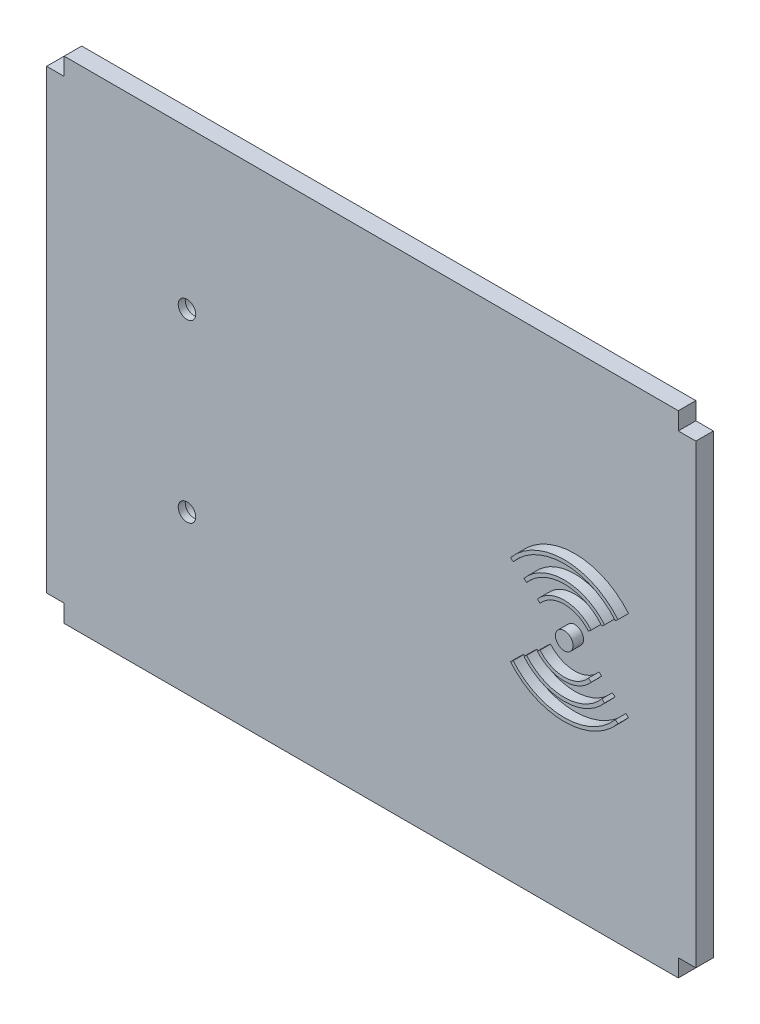
from build123d import *

# Parameters (mm, degrees)
BOSS_EXTRUDE1_DEPTH = 5
SKETCH2_R           = 2.5
CUT_EXTRUDE1_DEPTH  = 5
SKETCH3_R           = 3
CUT_EXTRUDE2_DEPTH  = 3
SKETCH4_R           = 2.5
BOSS_EXTRUDE2_DEPTH = 3


with BuildPart() as part:
    # Sketch1 → Boss-Extrude1 (new body)
    with BuildSketch(Plane.XY):
        Polygon((-87.5, 70), (-87.5, 65), (-92.5, 65), (-92.5, -65), (-87.5, -65), (-87.5, -70), (87.5, -70), (87.5, -65), (92.5, -65), (92.5, 65), (87.5, 65), (87.5, 70), align=None)
    extrude(amount=BOSS_EXTRUDE1_DEPTH)

    # Sketch2 → Cut-Extrude1 (cut)
    with BuildSketch(Plane.XY.offset(5)):
        with Locations((-52.5, -25)):
            Circle(SKETCH2_R)
        with Locations((-52.5, 25)):
            Circle(SKETCH2_R)
    extrude(amount=-CUT_EXTRUDE1_DEPTH, mode=Mode.SUBTRACT)

    # Sketch3 → Cut-Extrude2 (cut)
    with BuildSketch(Plane(origin=(0, 0, 0), x_dir=(-1, 0, 0), z_dir=(0, 0, -1))):
        with Locations((52.5, 25)):
            Circle(SKETCH3_R)
        with Locations((52.5, -25)):
            Circle(SKETCH3_R)
    extrude(amount=-CUT_EXTRUDE2_DEPTH, mode=Mode.SUBTRACT)

    # Sketch4 → Boss-Extrude2 (add)
    with BuildSketch(Plane.XY.offset(5)):
        with Locations(Location((58, 0, 0), (0, 0, 180))):
            Circle(SKETCH4_R)
        with BuildLine():
            Line((51.105600012, -5.785088487), (50.339555569, -6.427876097))
            ThreePointArc((50.339555569, -6.427876097), (58, -10), (65.660444431, -6.427876097))
            Line((65.660444431, -6.427876097), (64.894399988, -5.785088487))
            ThreePointArc((64.894399988, -5.785088487), (58, -9), (51.105600012, -5.785088487))
        make_face()
        with BuildLine():
            Line((68.724622204, -8.999026536), (69.490666647, -9.641814145))
            ThreePointArc((69.490666647, -9.641814145), (58, -15), (46.509333353, -9.641814145))
            Line((46.509333353, -9.641814145), (47.275377796, -8.999026536))
            ThreePointArc((47.275377796, -8.999026536), (58, -14), (68.724622204, -8.999026536))
        make_face()
        with BuildLine():
            Line((43.445155581, 12.212964584), (42.679111138, 12.855752194))
            ThreePointArc((42.679111138, 12.855752194), (58, 20), (73.320888862, 12.855752194))
            Line((73.320888862, 12.855752194), (72.554844419, 12.212964584))
            ThreePointArc((72.554844419, 12.212964584), (58, 19), (43.445155581, 12.212964584))
        make_face()
        with BuildLine():
            Line((47.275377796, 8.999026536), (46.509333353, 9.641814145))
            ThreePointArc((46.509333353, 9.641814145), (58, 15), (69.490666647, 9.641814145))
            Line((69.490666647, 9.641814145), (68.724622204, 8.999026536))
            ThreePointArc((68.724622204, 8.999026536), (58, 14), (47.275377796, 8.999026536))
        make_face()
        with BuildLine():
            Line((51.105600012, 5.785088487), (50.339555569, 6.427876097))
            ThreePointArc((50.339555569, 6.427876097), (58, 10), (65.660444431, 6.427876097))
            Line((65.660444431, 6.427876097), (64.894399988, 5.785088487))
            ThreePointArc((64.894399988, 5.785088487), (58, 9), (51.105600012, 5.785088487))
        make_face()
        with BuildLine():
            Line((43.445155581, -12.212964584), (42.679111138, -12.855752194))
            ThreePointArc((42.679111138, -12.855752194), (58, -20), (73.320888862, -12.855752194))
            Line((73.320888862, -12.855752194), (72.554844419, -12.212964584))
            ThreePointArc((72.554844419, -12.212964584), (58, -19), (43.445155581, -12.212964584))
        make_face()
    extrude(amount=BOSS_EXTRUDE2_DEPTH)


solid = part.part
